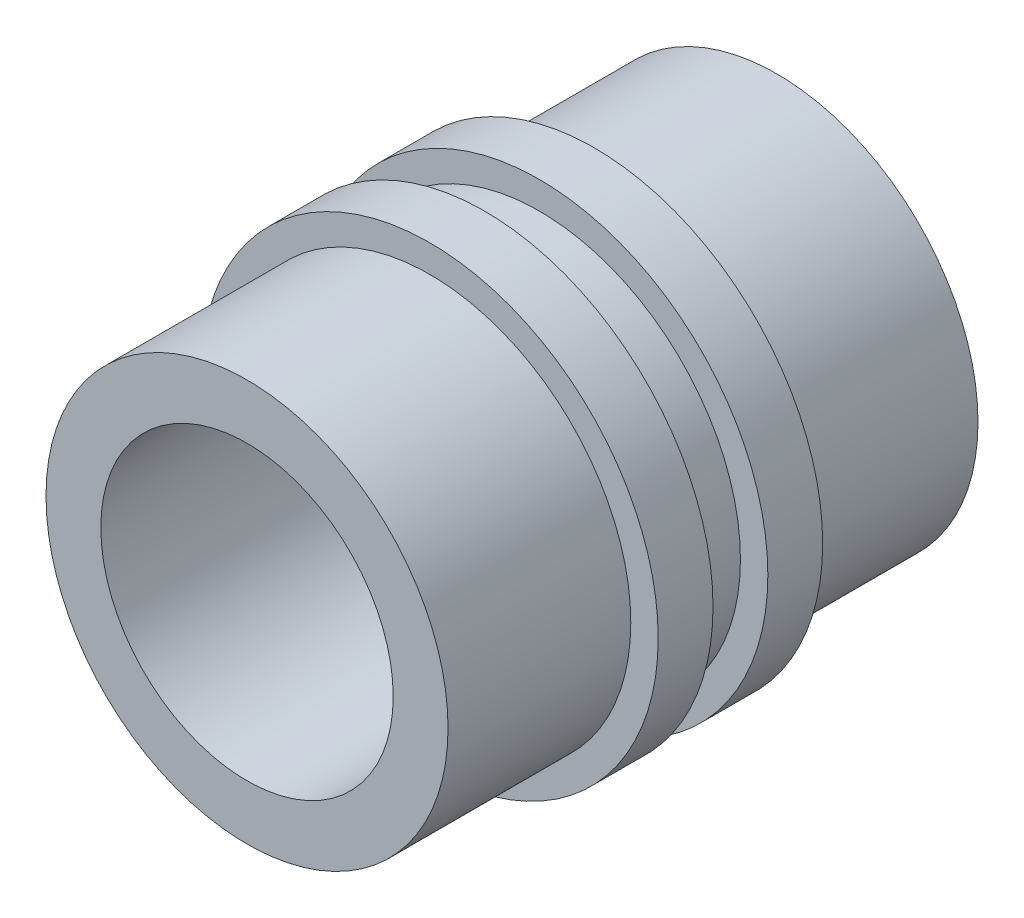
from build123d import *

# Parameters (mm, degrees)
ESQUISSE3_R             = 15
BOSS_EXTRU_2_DEPTH      = 3.6
ESQUISSE4_R             = 13.2
BOSS_EXTRU_3_DEPTH      = 12
BOSS_EXTRU_4_START      = 3.6
ESQUISSE5_R             = 13.2
BOSS_EXTRU_4_DEPTH      = 3.6
BOSS_EXTRU_5_START      = 3.6
ESQUISSE6_R             = 15
BOSS_EXTRU_5_DEPTH      = 3.6
BOSS_EXTRU_6_START      = 12
ESQUISSE7_R             = 13.2
BOSS_EXTRU_6_DEPTH      = 12
ESQUISSE8_R             = 9.6
ENL_V_MAT_EXTRU_2_DEPTH = 123


with BuildPart() as part:
    # Esquisse3 → Boss.-Extru.2 (new body)
    with BuildSketch(Plane.XY):
        Circle(ESQUISSE3_R)
    extrude(amount=-BOSS_EXTRU_2_DEPTH)

    # Esquisse4 → Boss.-Extru.3 (add)
    with BuildSketch(Plane(origin=(0, 0, -3.6), x_dir=(-1, 0, 0), z_dir=(0, 0, -1))):
        Circle(ESQUISSE4_R)
    extrude(amount=BOSS_EXTRU_3_DEPTH)

    # Esquisse5 → Boss.-Extru.4 (add)
    with BuildSketch(Plane.XY.offset(BOSS_EXTRU_4_START)):
        with Locations(Location((0, 0, 0), (0, 0, 180))):
            Circle(ESQUISSE5_R)
    extrude(amount=-BOSS_EXTRU_4_DEPTH)

    # Esquisse6 → Boss.-Extru.5 (add)
    with BuildSketch(Plane.XY.offset(3.6).offset(BOSS_EXTRU_5_START)):
        Circle(ESQUISSE6_R)
    extrude(amount=-BOSS_EXTRU_5_DEPTH)

    # Esquisse7 → Boss.-Extru.6 (add)
    with BuildSketch(Plane.XY.offset(7.2).offset(BOSS_EXTRU_6_START)):
        with Locations(Location((0, 0, 0), (0, 0, 180))):
            Circle(ESQUISSE7_R)
    extrude(amount=-BOSS_EXTRU_6_DEPTH)

    # Esquisse8 → Enlèv. mat.-Extru.2 (cut)
    with BuildSketch(Plane.XY.offset(19.2)):
        Circle(ESQUISSE8_R)
    extrude(amount=-ENL_V_MAT_EXTRU_2_DEPTH, mode=Mode.SUBTRACT)


solid = part.part
